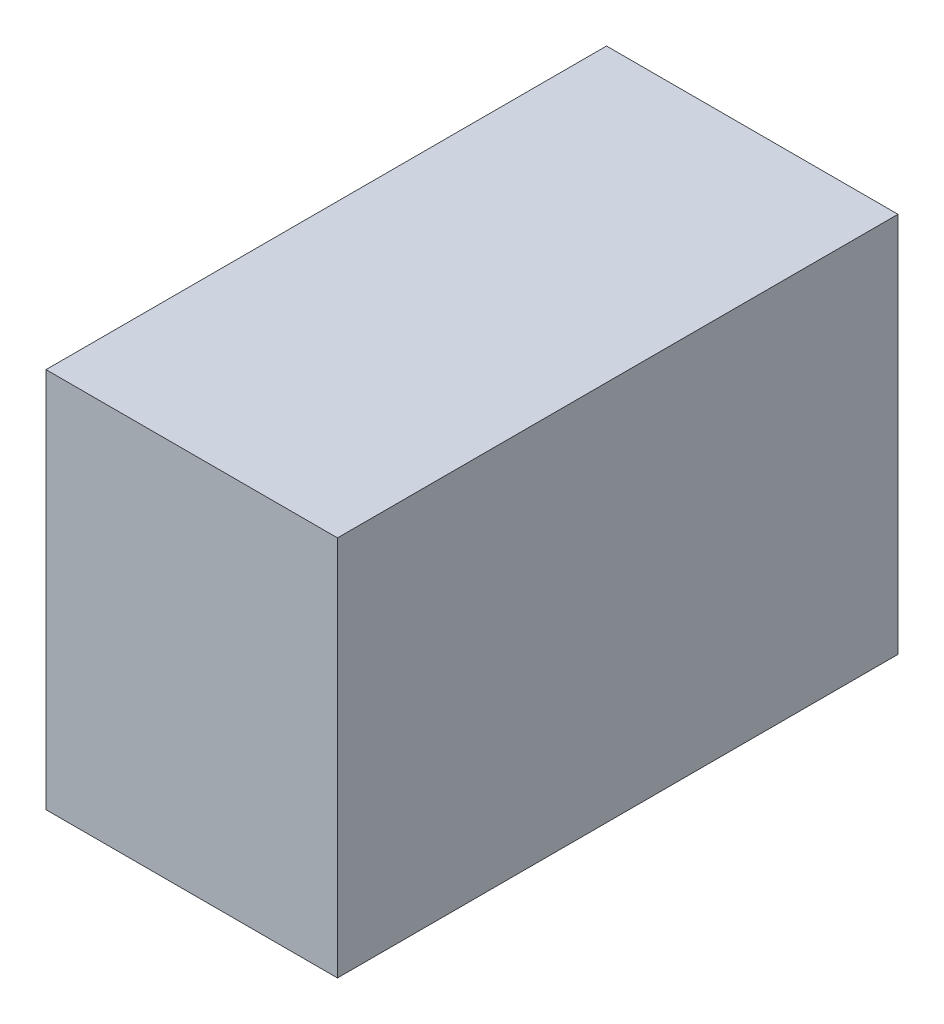
from build123d import *

# Parameters (mm, degrees)
SKETCH_1_W      = 130
SKETCH_1_H      = 170
EXTRUDE_1_DEPTH = 250


with BuildPart() as part:
    # 草图1 → 凸台-拉伸1 (new body)
    with BuildSketch(Plane.XY):
        Rectangle(SKETCH_1_W, SKETCH_1_H)
    extrude(amount=EXTRUDE_1_DEPTH)


solid = part.part
